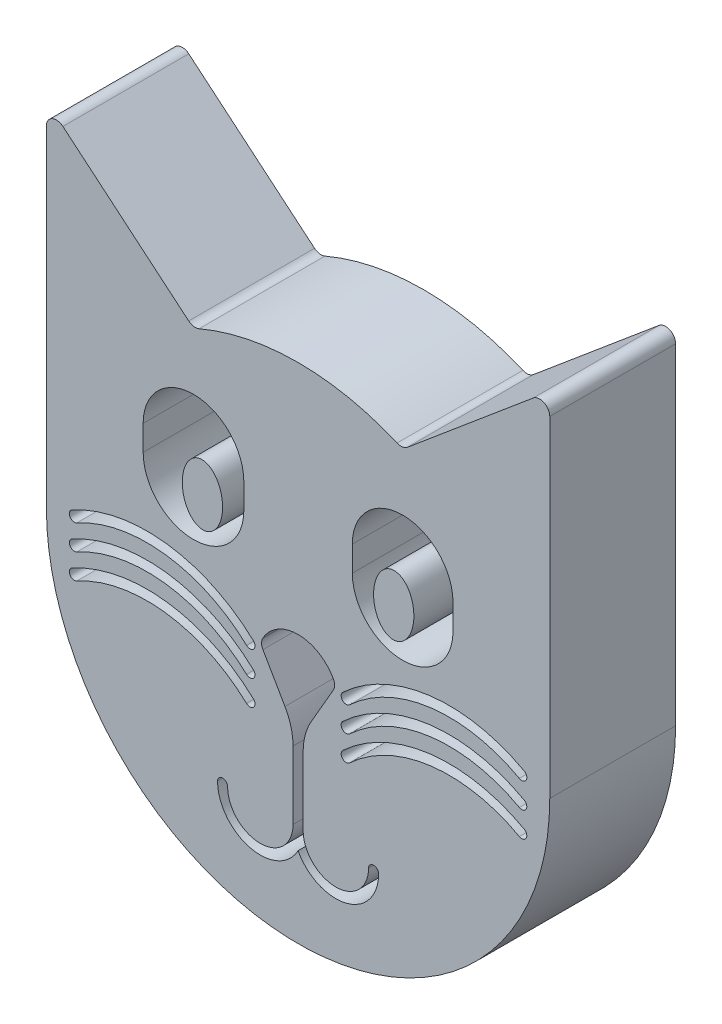
from build123d import *

# Parameters (mm, degrees)
SKETCH1_W           = 50.8
SKETCH1_H           = 50.8
BOSS_EXTRUDE1_DEPTH = 6.35
SKETCH4_W           = 50.8
SKETCH4_H           = 50.8
CUT_EXTRUDE7_DEPTH  = 6.35
FILLET4_R           = 0.508
FILLET5_R           = 3.048


with BuildPart() as part:
    # Sketch1 → Boss-Extrude1 (new body)
    with BuildSketch(Plane.XY):
        Rectangle(SKETCH1_W, SKETCH1_H)
    extrude(amount=BOSS_EXTRUDE1_DEPTH)

    # Sketch4 → Cut-Extrude7 (cut)
    # profile 1 of 10: a face of its own
    with BuildSketch(Plane.XY.offset(6.35)):
        Rectangle(SKETCH4_W, SKETCH4_H)
        with BuildLine():
            Line((-10.705776979, 0.152743606), (-10.705776979, 17.932743606))
            Line((-10.705776979, 17.932743606), (-3.283086722, 11.704366949))
            ThreePointArc((-3.283086722, 11.704366949), (1.994223021, 12.852743606), (7.271532765, 11.704366949))
            Line((7.271532765, 11.704366949), (14.694223021, 17.932743606))
            Line((14.694223021, 17.932743606), (14.694223021, 0.152743606))
            ThreePointArc((14.694223021, 0.152743606), (1.994223021, -12.547256394), (-10.705776979, 0.152743606))
        make_face(mode=Mode.SUBTRACT)
    # profile 2 of 10: a face of its own
    with BuildSketch(Plane.XY.offset(6.35)):
        with BuildLine():
            ThreePointArc((-9.416104266, 0.704431447), (-9.516470736, 0.359527733), (-9.171567022, 0.259161264))
            ThreePointArc((-9.171567022, 0.259161264), (-4.716848746, 1.112449856), (-0.606762542, -0.805832641))
            ThreePointArc((-0.606762542, -0.805832641), (-0.247781914, -0.792990941), (-0.260623615, -0.434010314))
            ThreePointArc((-0.260623615, -0.434010314), (-4.65416404, 1.616567529), (-9.416104266, 0.704431447))
        make_face()
    # profile 3 of 10: a face of its own
    with BuildSketch(Plane.XY.offset(6.35)):
        with BuildLine():
            ThreePointArc((-9.416104266, -1.835568553), (-9.516470736, -2.180472267), (-9.171567022, -2.280838736))
            ThreePointArc((-9.171567022, -2.280838736), (-4.716848746, -1.427550144), (-0.606762542, -3.345832641))
            ThreePointArc((-0.606762542, -3.345832641), (-0.247781914, -3.332990941), (-0.260623615, -2.974010314))
            ThreePointArc((-0.260623615, -2.974010314), (-4.65416404, -0.923432471), (-9.416104266, -1.835568553))
        make_face()
    # profile 4 of 10: a face of its own
    with BuildSketch(Plane.XY.offset(6.35)):
        with BuildLine():
            ThreePointArc((-9.416104266, -0.565568553), (-9.516470736, -0.910472267), (-9.171567022, -1.010838736))
            ThreePointArc((-9.171567022, -1.010838736), (-4.716848746, -0.157550144), (-0.606762542, -2.075832641))
            ThreePointArc((-0.606762542, -2.075832641), (-0.247781914, -2.062990941), (-0.260623615, -1.704010314))
            ThreePointArc((-0.260623615, -1.704010314), (-4.65416404, 0.346567529), (-9.416104266, -0.565568553))
        make_face()
    # profile 5 of 10: a face of its own
    with BuildSketch(Plane.XY.offset(6.35)):
        with BuildLine():
            ThreePointArc((13.404550309, -1.835568553), (8.642610082, -0.923432471), (4.249069657, -2.974010314))
            ThreePointArc((4.249069657, -2.974010314), (4.236227957, -3.332990941), (4.595208584, -3.345832641))
            ThreePointArc((4.595208584, -3.345832641), (8.705294788, -1.427550144), (13.160013064, -2.280838736))
            ThreePointArc((13.160013064, -2.280838736), (13.504916778, -2.180472267), (13.404550309, -1.835568553))
        make_face()
    # profile 6 of 10: a face of its own
    with BuildSketch(Plane.XY.offset(6.35)):
        with BuildLine():
            ThreePointArc((4.249069657, -0.434010314), (4.236227957, -0.792990941), (4.595208584, -0.805832641))
            ThreePointArc((4.595208584, -0.805832641), (8.705294788, 1.112449856), (13.160013064, 0.259161264))
            ThreePointArc((13.160013064, 0.259161264), (13.504916778, 0.359527733), (13.404550309, 0.704431447))
            ThreePointArc((13.404550309, 0.704431447), (8.642610082, 1.616567529), (4.249069657, -0.434010314))
        make_face()
    # profile 7 of 10: a face of its own
    with BuildSketch(Plane.XY.offset(6.35)):
        with BuildLine():
            ThreePointArc((13.404550309, -0.565568553), (8.642610082, 0.346567529), (4.249069657, -1.704010314))
            ThreePointArc((4.249069657, -1.704010314), (4.236227957, -2.062990941), (4.595208584, -2.075832641))
            ThreePointArc((4.595208584, -2.075832641), (8.705294788, -0.157550144), (13.160013064, -1.010838736))
            ThreePointArc((13.160013064, -1.010838736), (13.504916778, -0.910472267), (13.404550309, -0.565568553))
        make_face()
    # profile 8 of 10: a face of its own
    with BuildSketch(Plane.XY.offset(6.35)):
        with BuildLine():
            ThreePointArc((9.811532765, 6.28450646), (7.271532765, 8.82450646), (4.731532765, 6.28450646))
            Line((4.731532765, 6.28450646), (4.731532765, 5.01450646))
            ThreePointArc((4.731532765, 5.01450646), (7.271532765, 2.47450646), (9.811532765, 5.01450646))
            Line((9.811532765, 5.01450646), (9.811532765, 6.28450646))
        make_face()
        with BuildLine():
            add(Edge.make_bspline(
                [(6.77928811, 3.137346259), (8.538416808, 3.090078695), (7.720254826, 5.398887689), (6.902092844, 7.707696683), (5.961126128, 5.446155254), (5.020159411, 3.184613824), (6.77928811, 3.137346259)],
                knots=[0, 0, 0, 2.094395102, 2.094395102, 4.188790205, 4.188790205, 6.283185307, 6.283185307, 6.283185307], degree=2, weights=[1, 0.5, 1, 0.5, 1, 0.5, 1]))
        make_face(mode=Mode.SUBTRACT)
    # profile 9 of 10: a face of its own
    with BuildSketch(Plane.XY.offset(6.35)):
        with BuildLine():
            Line((-0.743086722, 5.01450646), (-0.743086722, 6.28450646))
            ThreePointArc((-0.743086722, 6.28450646), (-3.283086722, 8.82450646), (-5.823086722, 6.28450646))
            Line((-5.823086722, 6.28450646), (-5.823086722, 5.01450646))
            ThreePointArc((-5.823086722, 5.01450646), (-3.283086722, 2.47450646), (-0.743086722, 5.01450646))
        make_face()
        with BuildLine():
            add(Edge.make_bspline(
                [(-2.790842067, 3.137346259), (-1.031713369, 3.184613824), (-1.972680085, 5.446155254), (-2.913646802, 7.707696683), (-3.731808784, 5.398887689), (-4.549970766, 3.090078695), (-2.790842067, 3.137346259)],
                knots=[0, 0, 0, 2.094395102, 2.094395102, 4.188790205, 4.188790205, 6.283185307, 6.283185307, 6.283185307], degree=2, weights=[1, 0.5, 1, 0.5, 1, 0.5, 1]))
        make_face(mode=Mode.SUBTRACT)
    # profile 10 of 10: a face of its own
    with BuildSketch(Plane.XY.offset(6.35)):
        with BuildLine():
            ThreePointArc((1.867223021, -3.437285941), (1.774252569, -3.530256394), (1.740223021, -3.657256394))
            Line((1.740223021, -3.657256394), (1.740223021, -7.467256394))
            ThreePointArc((1.740223021, -7.467256394), (0.089223021, -9.118256394), (-1.561776979, -7.467256394))
            ThreePointArc((-1.561776979, -7.467256394), (-1.815776979, -7.213256394), (-2.069776979, -7.467256394))
            ThreePointArc((-2.069776979, -7.467256394), (-0.434411393, -9.561794052), (1.994223021, -8.483256394))
            ThreePointArc((1.994223021, -8.483256394), (4.422857436, -9.561794052), (6.058223021, -7.467256394))
            ThreePointArc((6.058223021, -7.467256394), (5.804223021, -7.213256394), (5.550223021, -7.467256394))
            ThreePointArc((5.550223021, -7.467256394), (3.899223021, -9.118256394), (2.248223021, -7.467256394))
            Line((2.248223021, -7.467256394), (2.248223021, -3.657256394))
            ThreePointArc((2.248223021, -3.657256394), (2.214193474, -3.530256394), (2.121223021, -3.437285941))
            Line((2.121223021, -3.437285941), (3.899223021, -0.357699606))
            ThreePointArc((3.899223021, -0.357699606), (1.994223021, 0.96719432), (0.089223021, -0.357699606))
            Line((0.089223021, -0.357699606), (1.867223021, -3.437285941))
        make_face()
    extrude(amount=-CUT_EXTRUDE7_DEPTH, mode=Mode.SUBTRACT)


with BuildPart() as cut_extrude7_piece_1:
    # of the separate pieces the step leaves, piece 1, a body of its own (cut_extrude7_pieces)
    add(part.part.solids().sort_by_distance((14.694223021, 17.932743606, 0))[0])

    # Fillet4
    fillet4_edges = [cut_extrude7_piece_1.edges().sort_by_distance(p)[0] for p in [
        (0.089223021, -0.357699606, 3.175),
        (3.899223021, -0.357699606, 3.175),
        (14.694223021, 17.932743606, 3.175),
        (7.271532765, 11.704366949, 3.175),
        (-3.283086722, 11.704366949, 3.175),
        (-10.705776979, 17.932743606, 3.175),
    ]]
    fillet(fillet4_edges, radius=FILLET4_R)

    # Fillet5
    fillet5_edges = [cut_extrude7_piece_1.edges().sort_by_distance(p)[0] for p in [
        (2.121223021, -3.437285941, 3.175),
        (1.867223021, -3.437285941, 3.175),
    ]]
    fillet(fillet5_edges, radius=FILLET5_R)


with BuildPart() as cut_extrude7_piece_2:
    # of the separate pieces the step leaves, piece 2, a body of its own (cut_extrude7_pieces)
    add(part.part.solids().sort_by_distance((-2.790842067, 3.137346259, 0))[0])


with BuildPart() as cut_extrude7_piece_3:
    # of the separate pieces the step leaves, piece 3, a body of its own (cut_extrude7_pieces)
    add(part.part.solids().sort_by_distance((6.77928811, 3.137346259, 0))[0])


solid = Compound([cut_extrude7_piece_1.part, cut_extrude7_piece_2.part, cut_extrude7_piece_3.part])
